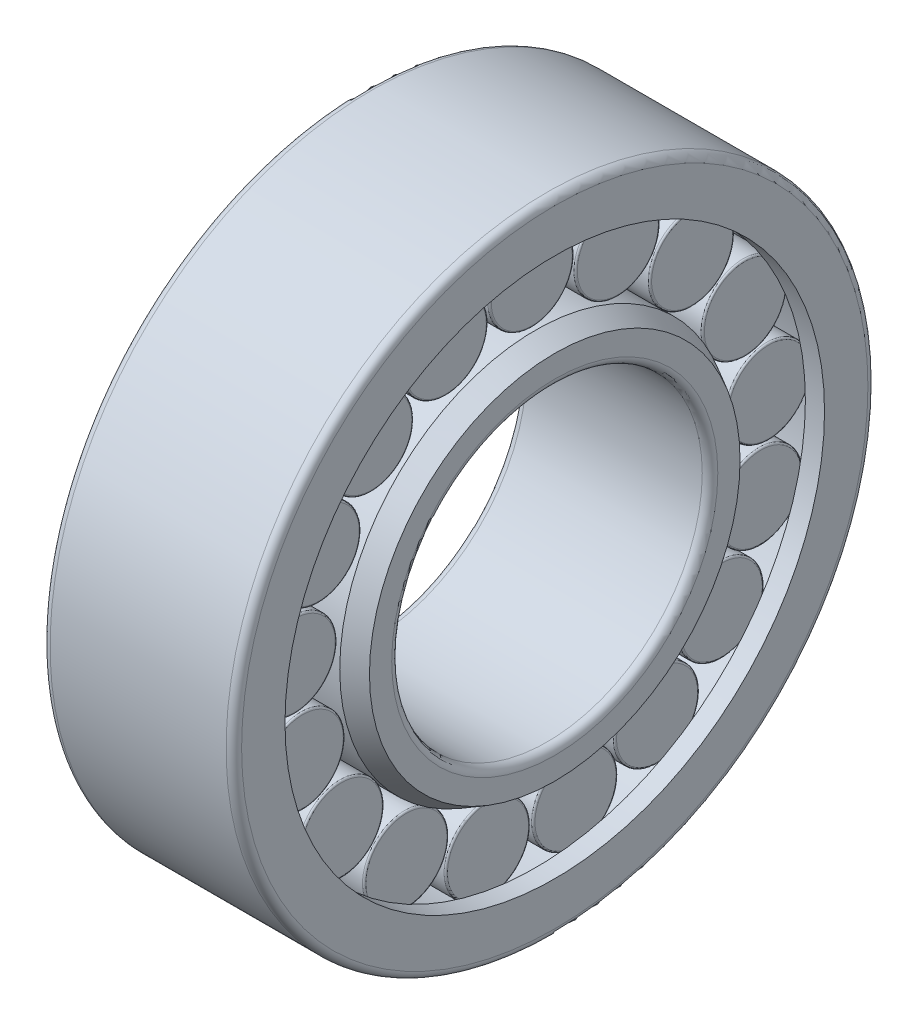
from build123d import *

# Parameters (mm, degrees)
ROLLERSDETAILED_COUNT = 17
ROLLERSDETAILED_ANGLE = 338.823529412


with BuildPart() as part:
    # OutRacSke → OuterRace (revolve)
    with BuildSketch(Plane.XY, mode=Mode.PRIVATE) as outerrace_sk:
        with BuildLine():
            Line((-74, 260.6), (-92.5, 260.6))
            Line((-92.5, 260.6), (-92.5, 302.5))
            ThreePointArc((-92.5, 302.5), (-90.303300859, 307.803300859), (-85, 310))
            Line((-85, 310), (85, 310))
            ThreePointArc((85, 310), (90.303300859, 307.803300859), (92.5, 302.5))
            Line((92.5, 302.5), (92.5, 260.6))
            Line((92.5, 260.6), (74, 260.6))
            Line((74, 260.6), (74, 270.8))
            Line((74, 270.8), (-74, 270.8))
            Line((-74, 270.8), (-74, 260.6))
        make_face()
    revolve(outerrace_sk.sketch.rotate(Axis((-90, 0, 0), (1, 0, 0)), 270), axis=Axis((-90, 0, 0), (1, 0, 0)))

    # RolDetSke → RollerDetailed (revolve)
    with BuildSketch(Plane.XY, mode=Mode.PRIVATE) as rollerdetailed_sk:
        with BuildLine():
            Line((-70.3, 269.1728), (-70.3, 230))
            Line((-70.3, 230), (70.3, 230))
            Line((70.3, 230), (70.3, 269.1728))
            ThreePointArc((70.3, 269.1728), (69.821939688, 270.326939688), (68.6678, 270.805))
            Line((68.6678, 270.805), (-68.6678, 270.805))
            ThreePointArc((-68.6678, 270.805), (-69.821939688, 270.326939688), (-70.3, 269.1728))
        make_face()
    rollerdetailed = revolve(rollerdetailed_sk.sketch.rotate(Axis((-33.6, 230, 0), (1, 0, 0)), 270), axis=Axis((-33.6, 230, 0), (1, 0, 0)))

    # InsRacSke → InnerRace (revolve)
    with BuildSketch(Plane.XY, mode=Mode.PRIVATE) as innerrace_sk:
        with BuildLine():
            Line((-74, 189.2), (-92.5, 179))
            Line((-92.5, 179), (-92.5, 157.5))
            ThreePointArc((-92.5, 157.5), (-90.303300859, 152.196699141), (-85, 150))
            Line((-85, 150), (85, 150))
            ThreePointArc((85, 150), (90.303300859, 152.196699141), (92.5, 157.5))
            Line((92.5, 157.5), (92.5, 179))
            Line((92.5, 179), (74, 189.2))
            Line((74, 189.2), (-74, 189.2))
        make_face()
    revolve(innerrace_sk.sketch.rotate(Axis((-90, 0, 0), (1, 0, 0)), 270), axis=Axis((-90, 0, 0), (1, 0, 0)))

    # RollersDetailed: RollerDetailed ×17 about axis
    rollersdetailed_axis = Axis((-50, 0, 0), (1, 0, 0))
    for i in range(1, ROLLERSDETAILED_COUNT):
        add(rollerdetailed.rotate(rollersdetailed_axis, i * ROLLERSDETAILED_ANGLE / (ROLLERSDETAILED_COUNT - 1)))


solid = part.part
